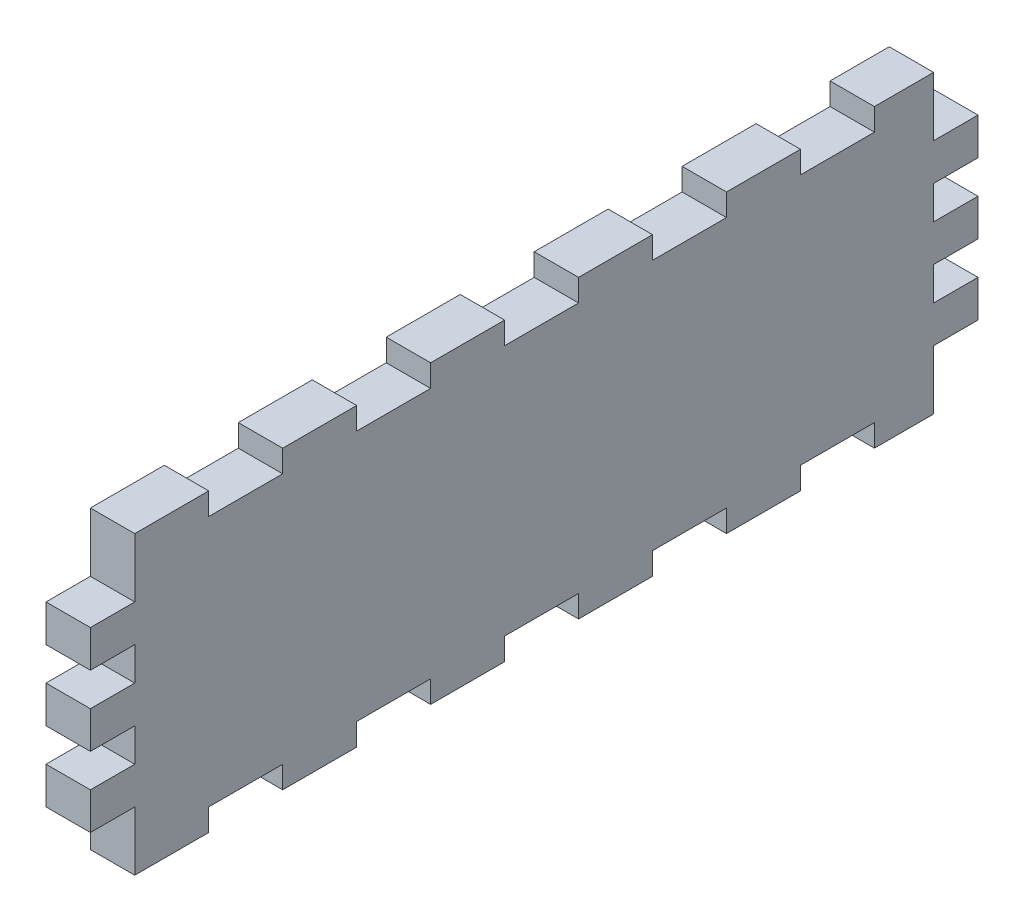
from build123d import *

# Parameters (mm, degrees)
SKETCH_1_W             = 108
SKETCH_1_H             = 40
EXTRUDE_2_DEPTH        = 6
SKETCH_3_W             = 6
SKETCH_3_H             = 5
EXTRUDE_3_DEPTH        = 6
SKETCH_4_W             = 6
SKETCH_4_H             = 5
EXTRUDE_4_DEPTH        = 6
SKETCH_5_W             = 6
SKETCH_5_H             = 10
CUT_EXTRUDE_1_DEPTH    = 4
SKETCH_6_W             = 6
SKETCH_6_H             = 10
EXTRUDE_5_DEPTH        = 1
PATTERN_LINEAR_1_COUNT = 5
PATTERN_LINEAR_1_PITCH = 20
SKETCH_8_W             = 6
SKETCH_8_H             = 10
CUT_EXTRUDE_2_DEPTH    = 3


with BuildPart() as part:
    # Эскиз1 → Бобышка-Вытянуть2 (new body)
    with BuildSketch(Plane(origin=(0, 0, 0), x_dir=(0, 0, -1), z_dir=(1, 0, 0))):
        with Locations((54, -20)):
            Rectangle(SKETCH_1_W, SKETCH_1_H)
    extrude(amount=EXTRUDE_2_DEPTH)

    # Эскиз3 → Бобышка-Вытянуть3 (add)
    with BuildSketch(Plane.XY):
        with Locations((3, -10.5)):
            Rectangle(SKETCH_3_W, SKETCH_3_H)
        with Locations((3, -20)):
            Rectangle(SKETCH_3_W, SKETCH_3_H)
        with Locations((3, -29.5)):
            Rectangle(SKETCH_3_W, SKETCH_3_H)
    extrude(amount=EXTRUDE_3_DEPTH)

    # Эскиз4 → Бобышка-Вытянуть4 (add)
    with BuildSketch(Plane(origin=(0, 0, -108), x_dir=(-1, 0, 0), z_dir=(0, 0, -1))):
        with Locations((-3, -10.5)):
            Rectangle(SKETCH_4_W, SKETCH_4_H)
        with Locations((-3, -20)):
            Rectangle(SKETCH_4_W, SKETCH_4_H)
        with Locations((-3, -29.5)):
            Rectangle(SKETCH_4_W, SKETCH_4_H)
    extrude(amount=EXTRUDE_4_DEPTH)

    # Эскиз5 → Вырез-Вытянуть1 (cut)
    with BuildSketch(Plane.XZ.offset(40)):
        with Locations((3, -15)):
            Rectangle(SKETCH_5_W, SKETCH_5_H)
        with Locations((3, -35)):
            Rectangle(SKETCH_5_W, SKETCH_5_H)
        with Locations((3, -55)):
            Rectangle(SKETCH_5_W, SKETCH_5_H)
        with Locations((3, -75)):
            Rectangle(SKETCH_5_W, SKETCH_5_H)
        with Locations((3, -95)):
            Rectangle(SKETCH_5_W, SKETCH_5_H)
    extrude(amount=-CUT_EXTRUDE_1_DEPTH, mode=Mode.SUBTRACT)

    # Эскиз6 → Бобышка-Вытянуть5 (add)
    with BuildSketch(Plane.XZ.offset(36)):
        with Locations((3, -15)):
            Rectangle(SKETCH_6_W, SKETCH_6_H)
    extrude_5 = extrude(amount=EXTRUDE_5_DEPTH)

    # Линейный массив1: Бобышка-Вытянуть5 ×5
    with Locations(*[(0, 0, -i * PATTERN_LINEAR_1_PITCH) for i in range(1, PATTERN_LINEAR_1_COUNT)]):
        add(extrude_5)

    # Эскиз8 → Вырез-Вытянуть2 (cut)
    with BuildSketch(Plane(origin=(0, 0, 0), x_dir=(1, 0, 0), z_dir=(0, 1, 0))):
        with Locations((3, 15)):
            Rectangle(SKETCH_8_W, SKETCH_8_H)
        with Locations((3, 35)):
            Rectangle(SKETCH_8_W, SKETCH_8_H)
        with Locations((3, 55)):
            Rectangle(SKETCH_8_W, SKETCH_8_H)
        with Locations((3, 75)):
            Rectangle(SKETCH_8_W, SKETCH_8_H)
        with Locations((3, 95)):
            Rectangle(SKETCH_8_W, SKETCH_8_H)
    extrude(amount=-CUT_EXTRUDE_2_DEPTH, mode=Mode.SUBTRACT)


solid = part.part
